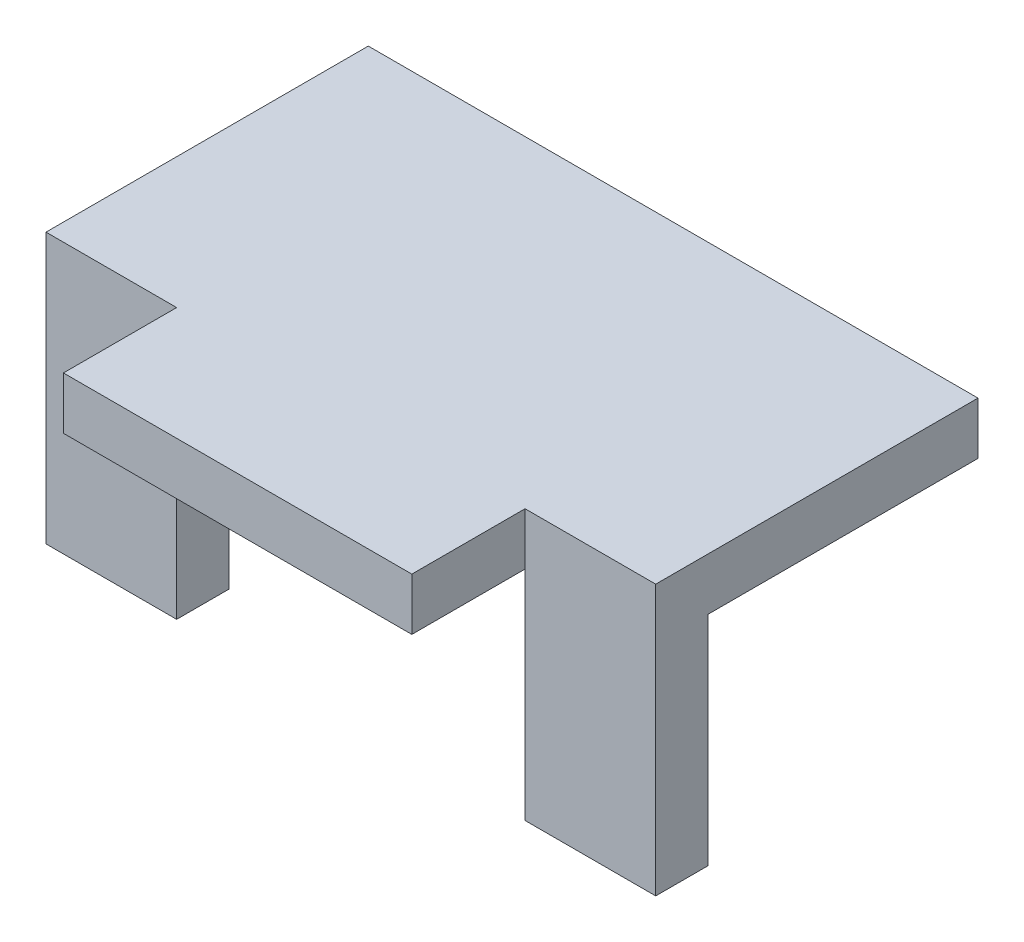
from build123d import *

# Parameters (mm, degrees)
SKETCH1_W           = 70
SKETCH1_H           = 50
BOSS_EXTRUDE1_DEPTH = 6
CUT_EXTRUDE1_DEPTH  = 44.428101501
SKETCH3_W           = 15
SKETCH3_H           = 6
BOSS_EXTRUDE2_DEPTH = 25


with BuildPart() as part:
    # Sketch1 → Boss-Extrude1 (new body)
    with BuildSketch(Plane(origin=(0, 0, 0), x_dir=(1, 0, 0), z_dir=(0, 1, 0))):
        Rectangle(SKETCH1_W, SKETCH1_H)
    extrude(amount=BOSS_EXTRUDE1_DEPTH)

    # Sketch2 → Cut-Extrude1 (cut, through all)
    with BuildSketch(Plane.XZ):
        Polygon((-35, 12), (-20, 12), (-20, 37.174487296), (-39.665128523, 37.174487296), (-39.665128523, 12), align=None)
        Polygon((39.665128523, 12), (35, 12), (20, 12), (20, 37.174487296), (39.665128523, 37.174487296), align=None)
    extrude(amount=-CUT_EXTRUDE1_DEPTH, mode=Mode.SUBTRACT)

    # Sketch3 → Boss-Extrude2 (add)
    with BuildSketch(Plane.XZ):
        with Locations((-27.5, 9)):
            Rectangle(SKETCH3_W, SKETCH3_H)
        with Locations((27.5, 9)):
            Rectangle(SKETCH3_W, SKETCH3_H)
    extrude(amount=BOSS_EXTRUDE2_DEPTH)


solid = part.part
